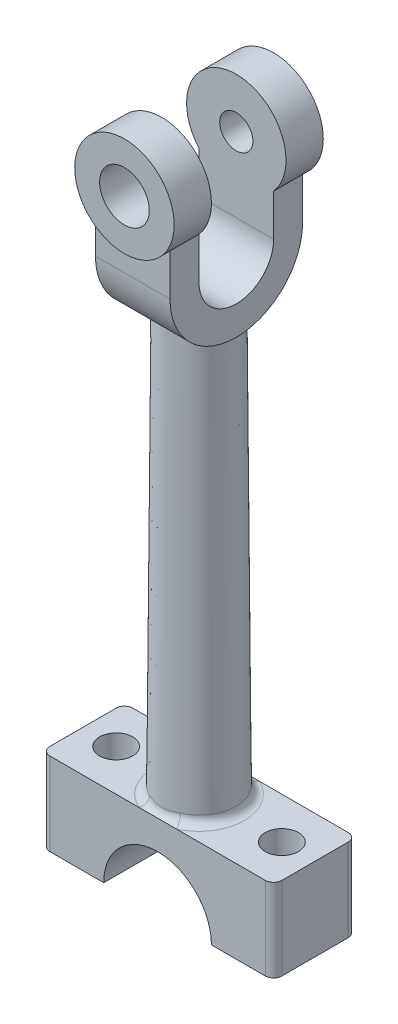
from build123d import *

# Parameters (mm, degrees)
SKETCH1_W                      = 28
SKETCH1_H                      = 10
BOSS_EXTRUDE1_DEPTH            = 5
SKETCH6_R                      = 6
BOSS_EXTRUDE3_DEPTH            = 9
BOSS_EXTRUDE4_DEPTH            = 4.5
CUT_EXTRUDE1_DEPTH             = 87.075548212
CUT_EXTRUDE1_DEPTH_BACK        = 87.075548212
SKETCH8_R                      = 2
CUT_EXTRUDE2_DEPTH             = 85.65222974
CUT_EXTRUDE2_DEPTH_BACK        = 85.65222974
CUT_EXTRUDE3_REACH             = 88.076
SKETCH10_R                     = 3
CUT_EXTRUDE3_DIRECTION_2_DEPTH = 87.075548212
CUT_EXTRUDE4_REACH             = 76.873
SKETCH11_R                     = 2
FILLET1_R                      = 1
FILLET2_R                      = 1
CUT_EXTRUDE5_DEPTH             = 85.65222974
CUT_EXTRUDE5_DEPTH_BACK        = 85.65222974


with BuildPart() as part:
    # Sketch1 → Boss-Extrude1 (new, symmetric)
    with BuildSketch(Plane.XY):
        with Locations((0, 5)):
            Rectangle(SKETCH1_W, SKETCH1_H)
    extrude(amount=BOSS_EXTRUDE1_DEPTH, both=True)

    # Sketch2 → Revolve2 (revolve)
    with BuildSketch(Plane(origin=(0, 0, 0), x_dir=(0, 0, -1), z_dir=(1, 0, 0)), mode=Mode.PRIVATE) as revolve2_sk:
        Polygon((0, 10), (0, 77), (-4, 77), (-4.5, 10), align=None)
    revolve(revolve2_sk.sketch.rotate(Axis((0, 10, 0), (0, 1, 0)), 180), axis=Axis((0, 10, 0), (0, 1, 0)))

    # Sketch6 → Boss-Extrude3 (add, symmetric)
    with BuildSketch(Plane.XY):
        with Locations((0, 77)):
            Circle(SKETCH6_R)
    extrude(amount=BOSS_EXTRUDE3_DEPTH, both=True)

    # Sketch7 → Boss-Extrude4 (add, symmetric)
    with BuildSketch(Plane(origin=(0, 0, 0), x_dir=(0, 0, -1), z_dir=(1, 0, 0))):
        with BuildLine():
            Line((-8, 77), (8, 77))
            Line((8, 77), (8, 68))
            ThreePointArc((8, 68), (0, 60), (-8, 68))
            Line((-8, 68), (-8, 77))
        make_face()
    extrude(amount=BOSS_EXTRUDE4_DEPTH, both=True)

    # Sketch8 → Cut-Extrude1 (cut, two sides: drawn at the far end of the back side and taken through both)
    with BuildSketch(Plane.XY.offset(9).offset(-CUT_EXTRUDE1_DEPTH_BACK)):
        with Locations((0, 77)):
            Circle(SKETCH8_R)
    extrude(amount=CUT_EXTRUDE1_DEPTH + CUT_EXTRUDE1_DEPTH_BACK, mode=Mode.SUBTRACT)

    # Sketch9 → Cut-Extrude2 (cut, two sides: drawn at the far end of the back side and taken through both)
    with BuildSketch(Plane(origin=(0, 0, 0), x_dir=(0, 0, -1), z_dir=(1, 0, 0)).offset(-CUT_EXTRUDE2_DEPTH_BACK)):
        with BuildLine():
            Line((-4.5, 68), (-4.5, 86.268805497))
            ThreePointArc((-4.5, 86.268805497), (0, 90.768805497), (4.5, 86.268805497))
            Line((4.5, 86.268805497), (4.5, 68))
            ThreePointArc((4.5, 68), (0, 63.5), (-4.5, 68))
        make_face()
    extrude(amount=CUT_EXTRUDE2_DEPTH + CUT_EXTRUDE2_DEPTH_BACK, mode=Mode.SUBTRACT)

    # Sketch10 → Cut-Extrude3 (cut, up to next)
    with BuildSketch(Plane.XY.offset(9), mode=Mode.PRIVATE) as cut_extrude3_sk1:
        with Locations((0, 77)):
            Circle(SKETCH10_R)
    cut_extrude3_tool1 = extrude(cut_extrude3_sk1.sketch, amount=-CUT_EXTRUDE3_REACH, mode=Mode.PRIVATE) & part.part
    add(cut_extrude3_tool1.solids().sort_by_distance((0, 77, 9))[0], mode=Mode.SUBTRACT)

    # Sketch10 → Cut-Extrude3 direction 2 (cut)
    with BuildSketch(Plane.XY.offset(9)):
        with Locations((0, 77)):
            Circle(SKETCH10_R)
    extrude(amount=CUT_EXTRUDE3_DIRECTION_2_DEPTH, mode=Mode.SUBTRACT)

    # Sketch11 → Cut-Extrude4 (cut, up to next)
    with BuildSketch(Plane(origin=(0, 10, 0), x_dir=(1, 0, 0), z_dir=(0, 1, 0)), mode=Mode.PRIVATE) as cut_extrude4_sk1:
        with Locations(Location((-10, 0, 0), (0, 0, 270))):
            Circle(SKETCH11_R)
    cut_extrude4_tool1 = extrude(cut_extrude4_sk1.sketch, amount=-CUT_EXTRUDE4_REACH, mode=Mode.PRIVATE) & part.part
    # Sketch11 → Cut-Extrude4 (cut, up to next)
    with BuildSketch(Plane(origin=(0, 10, 0), x_dir=(1, 0, 0), z_dir=(0, 1, 0)), mode=Mode.PRIVATE) as cut_extrude4_sk2:
        with Locations(Location((10, 0, 0), (0, 0, 270))):
            Circle(SKETCH11_R)
    cut_extrude4_tool2 = extrude(cut_extrude4_sk2.sketch, amount=-CUT_EXTRUDE4_REACH, mode=Mode.PRIVATE) & part.part
    add(cut_extrude4_tool1.solids().sort_by_distance((-10, 10, 0))[0], mode=Mode.SUBTRACT)
    add(cut_extrude4_tool2.solids().sort_by_distance((10, 10, 0))[0], mode=Mode.SUBTRACT)

    # Fillet1
    fillet1_edges = [part.edges().sort_by_distance(p)[0] for p in [
        (14, 5, 5),
        (-14, 5, 5),
        (14, 5, -5),
        (-14, 5, -5),
    ]]
    fillet(fillet1_edges, radius=FILLET1_R)

    # Fillet2
    fillet2_edges = [part.edges().sort_by_distance(p)[0] for p in [
        (0, 10, 4.5),
    ]]
    fillet(fillet2_edges, radius=FILLET2_R)

    # Sketch12 → Cut-Extrude5 (cut, two sides: drawn at the far end of the back side and taken through both)
    with BuildSketch(Plane.XY.offset(-CUT_EXTRUDE5_DEPTH_BACK)):
        with BuildLine():
            Line((-6.5, 0), (6.5, 0))
            ThreePointArc((6.5, 0), (0, 6.5), (-6.5, 0))
        make_face()
    extrude(amount=CUT_EXTRUDE5_DEPTH + CUT_EXTRUDE5_DEPTH_BACK, mode=Mode.SUBTRACT)


solid = part.part
